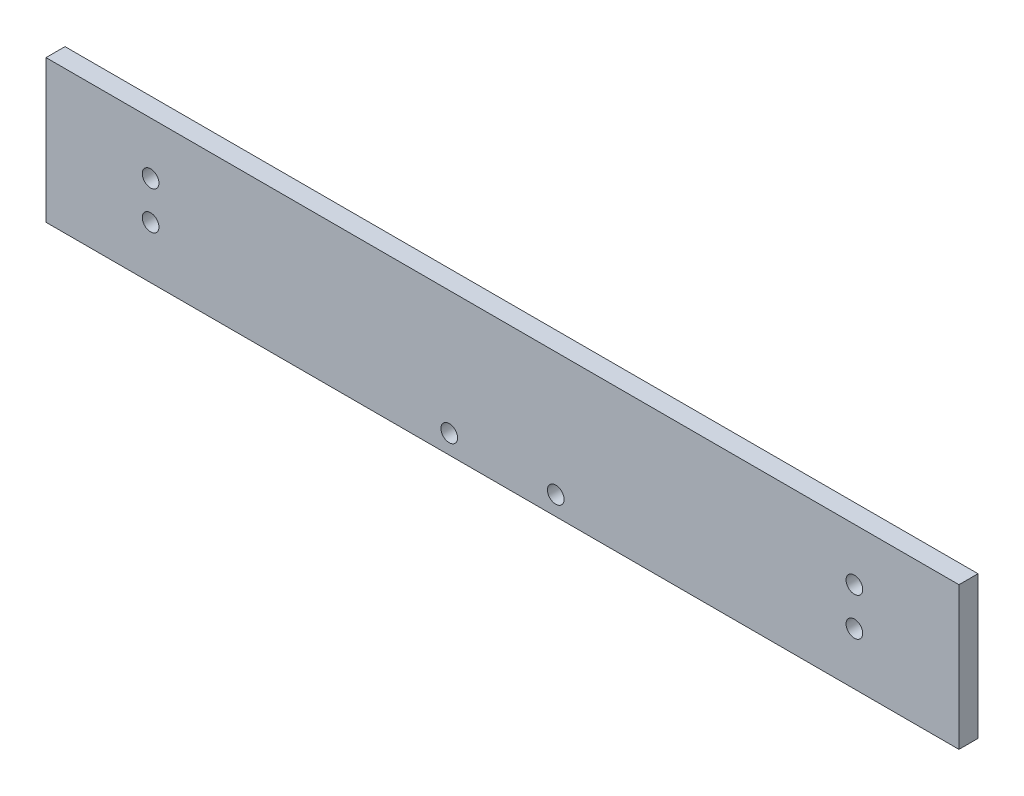
from build123d import *

# Parameters (mm, degrees)
SKETCH_1_R      = 1.75
SKETCH_1_W      = 29
SKETCH_1_H      = 7
EXTRUDE_2_DEPTH = 4


with BuildPart() as part:
    # 스케치1 → 보스-돌출2 (new body)
    # profile 1 of 2: a face of its own
    with BuildSketch(Plane.XY):
        Polygon((-91.394765949, 13.238815007), (-91.394765949, -16.761184993), (-9.894765949, -16.761184993), (-9.894765949, -9.761184993), (19.105234051, -9.761184993), (19.105234051, -16.761184993), (100.605234051, -16.761184993), (100.605234051, 13.238815007), align=None)
        with Locations((-69.394765949, -5.761184993)):
            Circle(SKETCH_1_R, mode=Mode.SUBTRACT)
        with Locations((78.605234051, -5.761184993)):
            Circle(SKETCH_1_R, mode=Mode.SUBTRACT)
        with Locations((-69.394765949, 2.238815007)):
            Circle(SKETCH_1_R, mode=Mode.SUBTRACT)
        with Locations((78.605234051, 2.238815007)):
            Circle(SKETCH_1_R, mode=Mode.SUBTRACT)
    # profile 2 of 2: a face of its own
    with BuildSketch(Plane.XY):
        with Locations((4.605234051, -13.261184993)):
            Rectangle(SKETCH_1_W, SKETCH_1_H)
        with Locations((-6.594765949, -12.761184993)):
            Circle(SKETCH_1_R, mode=Mode.SUBTRACT)
        with Locations((15.805234051, -12.761184993)):
            Circle(SKETCH_1_R, mode=Mode.SUBTRACT)
    extrude(amount=EXTRUDE_2_DEPTH)


solid = part.part
